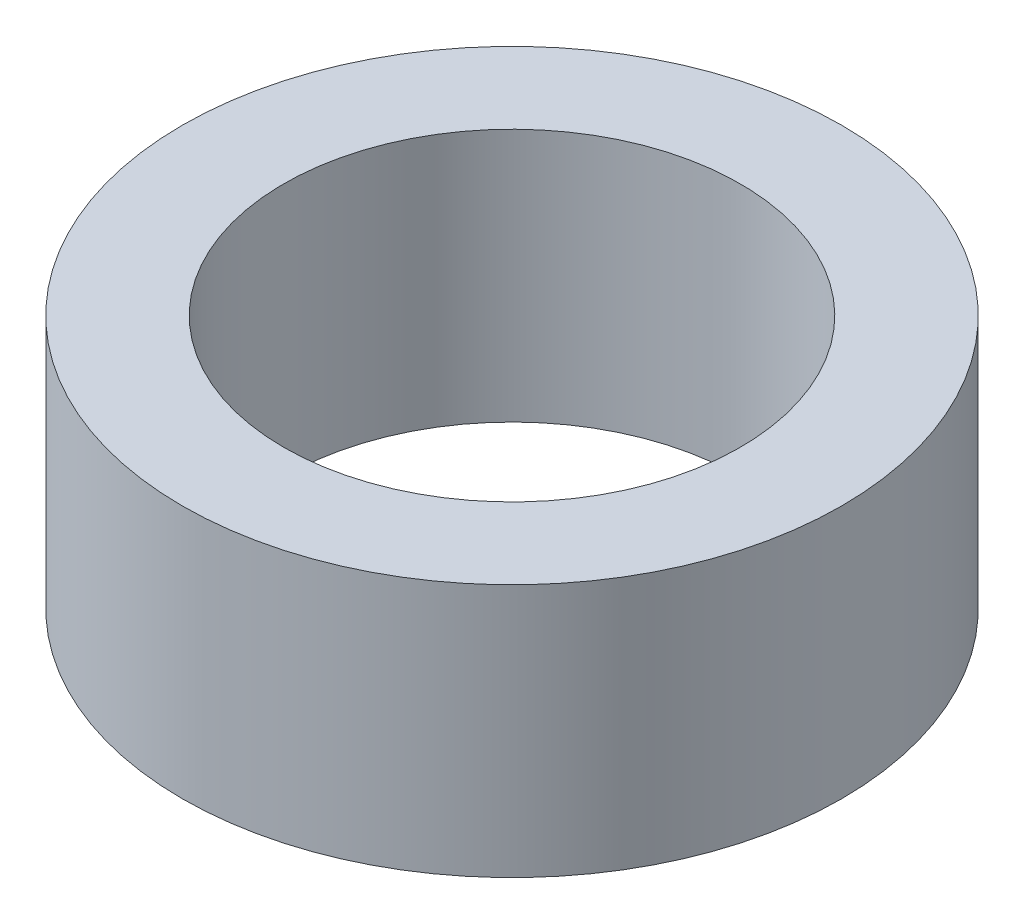
from build123d import *

# Parameters (mm, degrees)
SKETCH1_R           = 6.5
SKETCH1_R_2         = 4.5
BOSS_EXTRUDE1_DEPTH = 5


with BuildPart() as part:
    # Sketch1 → Boss-Extrude1 (new body)
    with BuildSketch(Plane(origin=(0, 0, 0), x_dir=(1, 0, 0), z_dir=(0, 1, 0))):
        with Locations(Location((0, 0, 0), (0, 0, 270))):
            Circle(SKETCH1_R)
        with Locations(Location((0, 0, 0), (0, 0, 270))):
            Circle(SKETCH1_R_2, mode=Mode.SUBTRACT)
    extrude(amount=BOSS_EXTRUDE1_DEPTH)


solid = part.part
